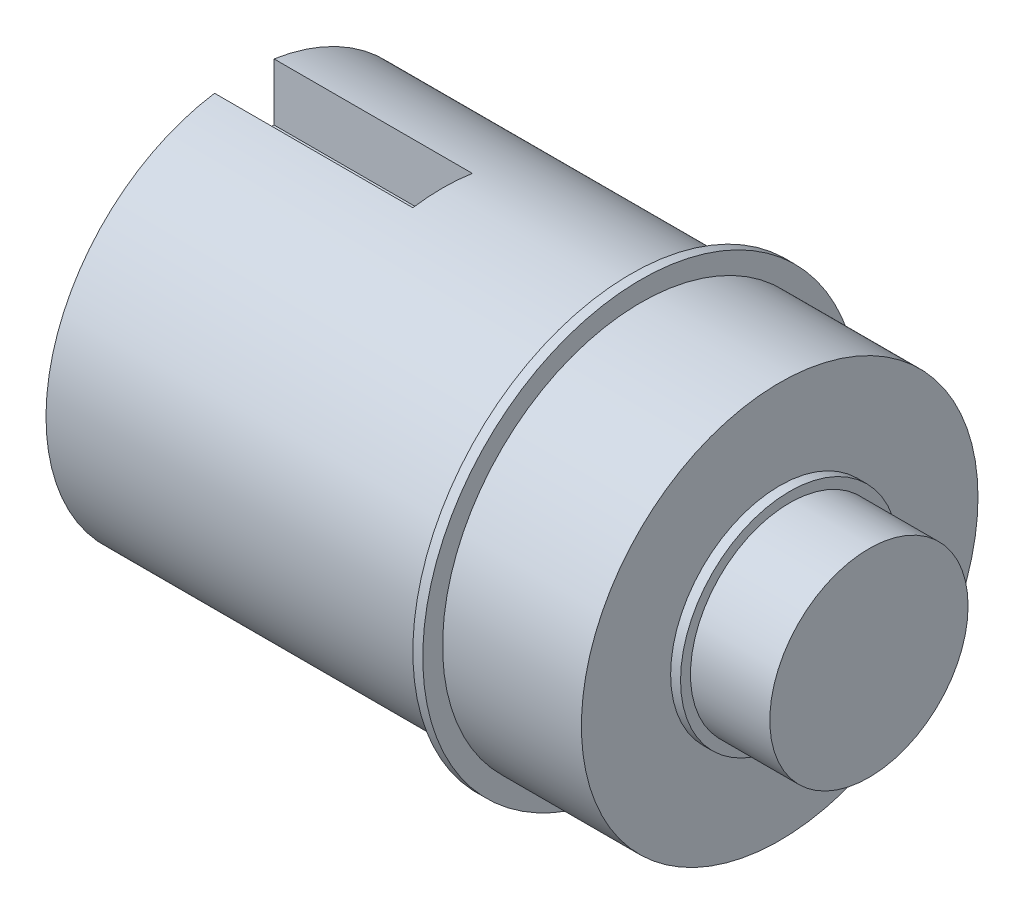
from build123d import *

# Parameters (mm, degrees)
SKETCH1_W          = 0.5
SKETCH1_H          = 1
SKETCH2_W          = 3
SKETCH2_H          = 6
CUT_EXTRUDE1_DEPTH = 10


with BuildPart() as part:
    # Sketch1 → Revolve1 (revolve)
    with BuildSketch(Plane.XY, mode=Mode.PRIVATE) as revolve1_sk:
        Polygon((31.5, 0), (0, 0), (0, 10), (27, 10), (27, 5.5), (27.5, 5.5), (27.5, 5), (31.5, 5), align=None)
        with Locations((19.75, 10.5)):
            Rectangle(SKETCH1_W, SKETCH1_H)
    revolve(revolve1_sk.sketch.rotate(Axis((0, 0, 0), (-1, 0, 0)), 90), axis=Axis((0, 0, 0), (-1, 0, 0)))

    # Sketch2 → Cut-Extrude1 (cut)
    with BuildSketch(Plane.ZY):
        with Locations((0, 10)):
            Rectangle(SKETCH2_W, SKETCH2_H)
    extrude(amount=-CUT_EXTRUDE1_DEPTH, mode=Mode.SUBTRACT)


solid = part.part
